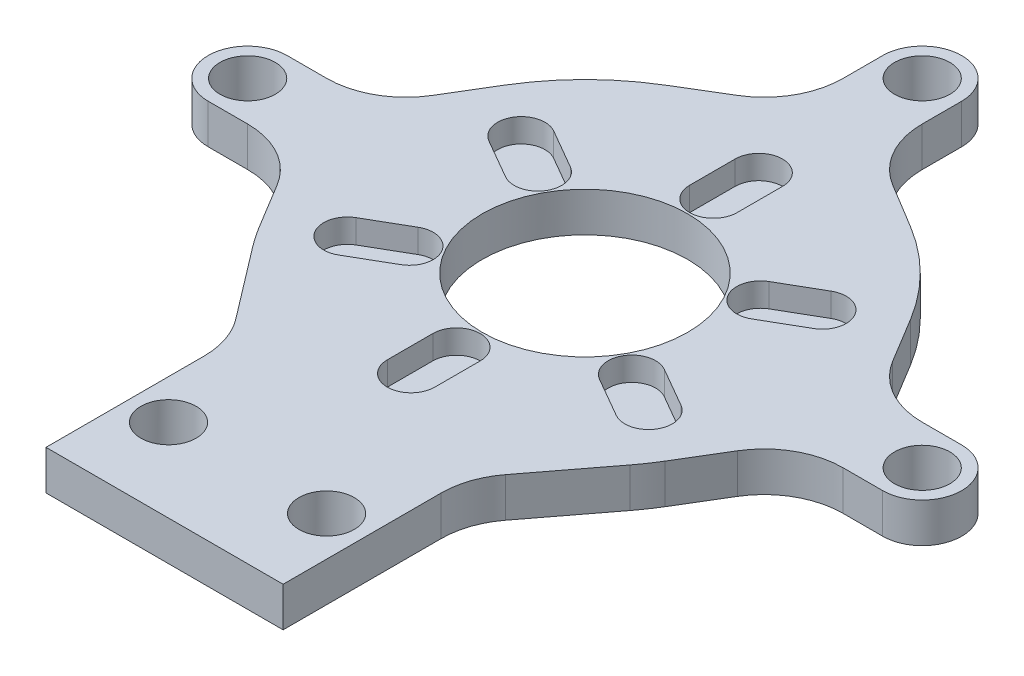
from build123d import *
from build123d.topology import SkipClean

# Parameters (mm, degrees)
ESQUISSE1_R             = 30
ESQUISSE1_R_2           = 13
BOSS_EXTRU_1_DEPTH      = 3
BOSS_EXTRU_2_START      = 2
ESQUISSE2_R             = 30
ESQUISSE2_R_2           = 13
BOSS_EXTRU_2_DEPTH      = 2
BOSS_EXTRU_3_START      = -5
ESQUISSE3_R             = 3.5
BOSS_EXTRU_3_DEPTH      = 5
ESQUISSE4_R             = 3.5
ENL_V_MAT_EXTRU_1_DEPTH = 72.599371852


with BuildPart() as part:
    # Esquisse1 → Boss.-Extru.1 (new body)
    with BuildSketch(Plane(origin=(0, 0, 0), x_dir=(1, 0, 0), z_dir=(0, 1, 0))):
        with Locations(Location((0, 0, 0), (0, 0, 270))):
            Circle(ESQUISSE1_R)
        with Locations(Location((0, 0, 0), (0, 0, 270))):
            Circle(ESQUISSE1_R_2, mode=Mode.SUBTRACT)
        with BuildLine():
            Line((-3, 16.25), (-3, 22))
            ThreePointArc((-3, 22), (0, 25), (3, 22))
            Line((3, 22), (3, 16.25))
            ThreePointArc((3, 16.25), (0, 13.25), (-3, 16.25))
        make_face(mode=Mode.SUBTRACT)
        with BuildLine():
            Line((12.572912811, 10.723076211), (17.552558883, 13.598076211))
            ThreePointArc((17.552558883, 13.598076211), (21.650635095, 12.5), (20.552558883, 8.401923789))
            Line((20.552558883, 8.401923789), (15.572912811, 5.526923789))
            ThreePointArc((15.572912811, 5.526923789), (11.4748366, 6.625), (12.572912811, 10.723076211))
        make_face(mode=Mode.SUBTRACT)
        with BuildLine():
            Line((15.572912811, -5.526923789), (20.552558883, -8.401923789))
            ThreePointArc((20.552558883, -8.401923789), (21.650635095, -12.5), (17.552558883, -13.598076211))
            Line((17.552558883, -13.598076211), (12.572912811, -10.723076211))
            ThreePointArc((12.572912811, -10.723076211), (11.4748366, -6.625), (15.572912811, -5.526923789))
        make_face(mode=Mode.SUBTRACT)
        with BuildLine():
            Line((3, -16.25), (3, -22))
            ThreePointArc((3, -22), (0, -25), (-3, -22))
            Line((-3, -22), (-3, -16.25))
            ThreePointArc((-3, -16.25), (0, -13.25), (3, -16.25))
        make_face(mode=Mode.SUBTRACT)
        with BuildLine():
            Line((-12.572912811, -10.723076211), (-17.552558883, -13.598076211))
            ThreePointArc((-17.552558883, -13.598076211), (-21.650635095, -12.5), (-20.552558883, -8.401923789))
            Line((-20.552558883, -8.401923789), (-15.572912811, -5.526923789))
            ThreePointArc((-15.572912811, -5.526923789), (-11.4748366, -6.625), (-12.572912811, -10.723076211))
        make_face(mode=Mode.SUBTRACT)
        with BuildLine():
            Line((-15.572912811, 5.526923789), (-20.552558883, 8.401923789))
            ThreePointArc((-20.552558883, 8.401923789), (-21.650635095, 12.5), (-17.552558883, 13.598076211))
            Line((-17.552558883, 13.598076211), (-12.572912811, 10.723076211))
            ThreePointArc((-12.572912811, 10.723076211), (-11.4748366, 6.625), (-15.572912811, 5.526923789))
        make_face(mode=Mode.SUBTRACT)
    extrude(amount=BOSS_EXTRU_1_DEPTH)

    # Esquisse2 → Boss.-Extru.2 (add)
    with BuildSketch(Plane.XZ.offset(BOSS_EXTRU_2_START)):
        with Locations(Location((0, 0, 0), (0, 0, 270))):
            Circle(ESQUISSE2_R)
        with Locations(Location((0, 0, 0), (0, 0, 270))):
            Circle(ESQUISSE2_R_2, mode=Mode.SUBTRACT)
    extrude(amount=-BOSS_EXTRU_2_DEPTH)

    # Esquisse3 → Boss.-Extru.3 (add)
    # profile 1 of 4: a face of its own
    with SkipClean():  # the faces are left unmerged after this step: merging them gives an invalid solid
        with BuildSketch(Plane(origin=(0, 3, 0), x_dir=(1, 0, 0), z_dir=(0, 1, 0)).offset(BOSS_EXTRU_3_START)):
            with BuildLine():
                Line((-15, -33.185852199), (-15, -53.185852199))
                Line((-15, -53.185852199), (15, -53.185852199))
                Line((15, -53.185852199), (15, -33.185852199))
                ThreePointArc((15, -33.185852199), (15.525518495, -29.986758544), (17.046840042, -27.123901466))
                Line((17.046840042, -27.123901466), (23.859479873, -18.185852199))
                ThreePointArc((23.859479873, -18.185852199), (0, -30), (-23.859479873, -18.185852199))
                Line((-23.859479873, -18.185852199), (-17.046840042, -27.123901466))
                ThreePointArc((-17.046840042, -27.123901466), (-15.525518495, -29.986758544), (-15, -33.185852199))
            make_face()
            with Locations(Location((-10, -42.685852199, 0), (0, 0, 270))):
                Circle(ESQUISSE3_R, mode=Mode.SUBTRACT)
            with Locations(Location((10, -42.685852199, 0), (0, 0, 270))):
                Circle(ESQUISSE3_R, mode=Mode.SUBTRACT)
        # profile 2 of 4: a face of its own
        with BuildSketch(Plane(origin=(0, 3, 0), x_dir=(1, 0, 0), z_dir=(0, 1, 0)).offset(BOSS_EXTRU_3_START)):
            with BuildLine():
                Line((37.673212347, 5), (42.673212347, 5))
                ThreePointArc((42.673212347, 5), (47.673212347, 0), (42.673212347, -5))
                Line((42.673212347, -5), (37.673212347, -5))
                ThreePointArc((37.673212347, -5), (32.760729603, -6.289804061), (29.115474898, -9.826497342))
                Line((29.115474898, -9.826497342), (25.673212347, -15.520507974))
                ThreePointArc((25.673212347, -15.520507974), (30, 0), (25.673212347, 15.520507974))
                Line((25.673212347, 15.520507974), (29.115474898, 9.826497342))
                ThreePointArc((29.115474898, 9.826497342), (32.760729603, 6.289804061), (37.673212347, 5))
            make_face()
        # profile 3 of 4: a face of its own
        with BuildSketch(Plane(origin=(0, 3, 0), x_dir=(1, 0, 0), z_dir=(0, 1, 0)).offset(BOSS_EXTRU_3_START)):
            with BuildLine():
                Line((-5, 37.673212347), (-5, 42.673212347))
                ThreePointArc((-5, 42.673212347), (0, 47.673212347), (5, 42.673212347))
                Line((5, 42.673212347), (5, 37.673212347))
                ThreePointArc((5, 37.673212347), (6.289804061, 32.760729603), (9.826497342, 29.115474898))
                Line((9.826497342, 29.115474898), (15.520507974, 25.673212347))
                ThreePointArc((15.520507974, 25.673212347), (0, 30), (-15.520507974, 25.673212347))
                Line((-15.520507974, 25.673212347), (-9.826497342, 29.115474898))
                ThreePointArc((-9.826497342, 29.115474898), (-6.289804061, 32.760729603), (-5, 37.673212347))
            make_face()
        # profile 4 of 4: a face of its own
        with BuildSketch(Plane(origin=(0, 3, 0), x_dir=(1, 0, 0), z_dir=(0, 1, 0)).offset(BOSS_EXTRU_3_START)):
            with BuildLine():
                Line((-37.673212347, -5), (-42.673212347, -5))
                ThreePointArc((-42.673212347, -5), (-47.673212347, 0), (-42.673212347, 5))
                Line((-42.673212347, 5), (-37.673212347, 5))
                ThreePointArc((-37.673212347, 5), (-32.760729603, 6.289804061), (-29.115474898, 9.826497342))
                Line((-29.115474898, 9.826497342), (-25.673212347, 15.520507974))
                ThreePointArc((-25.673212347, 15.520507974), (-30, 0), (-25.673212347, -15.520507974))
                Line((-25.673212347, -15.520507974), (-29.115474898, -9.826497342))
                ThreePointArc((-29.115474898, -9.826497342), (-32.760729603, -6.289804061), (-37.673212347, -5))
            make_face()
        extrude(amount=BOSS_EXTRU_3_DEPTH)

    # Esquisse4 → Enlèv. mat.-Extru.1 (cut, through all)
    with SkipClean():  # the faces are left unmerged after this step: merging them gives an invalid solid
        with BuildSketch(Plane(origin=(0, 3, 0), x_dir=(1, 0, 0), z_dir=(0, 1, 0))):
            with Locations(Location((-42.673212347, 0, 0), (0, 0, 270))):
                Circle(ESQUISSE4_R)
            with Locations(Location((42.673212347, 0, 0), (0, 0, 270))):
                Circle(ESQUISSE4_R)
            with Locations(Location((0, 42.673212347, 0), (0, 0, 270))):
                Circle(ESQUISSE4_R)
        extrude(amount=-ENL_V_MAT_EXTRU_1_DEPTH, mode=Mode.SUBTRACT)


solid = part.part
